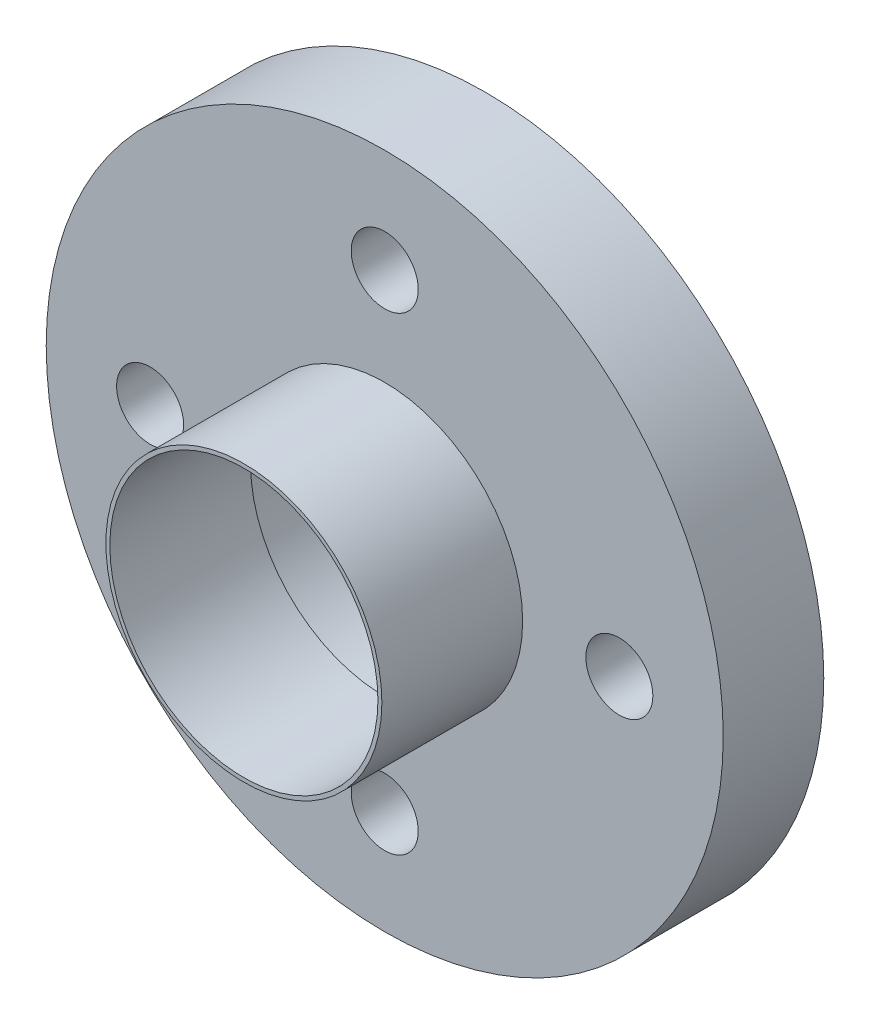
from build123d import *

# Parameters (mm, degrees)
IZIM1_R                     = 1
IZIM1_R_2                   = 4.1
Y_KSEKLIK_EKSTR_ZYON1_DEPTH = 3
IZIM4_R                     = 4.117295272
IZIM4_R_2                   = 4
Y_KSEKLIK_EKSTR_ZYON4_DEPTH = 4.2


with BuildPart() as part:
    # Çizim1 → Yükseklik-Ekstrüzyon1 (new body)
    with BuildSketch(Plane.XY):
        with BuildLine():
            ThreePointArc((-49.825075544, 1.124382022), (-59.925075544, -8.975617978), (-49.825075544, -19.075617978))
            ThreePointArc((-49.825075544, -19.075617978), (-39.725075544, -8.975617978), (-49.825075544, 1.124382022))
        make_face()
        with Locations((-49.825075544, -15.975617978)):
            Circle(IZIM1_R, mode=Mode.SUBTRACT)
        with Locations((-56.825075544, -8.975617978)):
            Circle(IZIM1_R, mode=Mode.SUBTRACT)
        with Locations((-49.825075544, -1.975617978)):
            Circle(IZIM1_R, mode=Mode.SUBTRACT)
        with Locations((-42.825075544, -8.975617978)):
            Circle(IZIM1_R, mode=Mode.SUBTRACT)
        with Locations((-49.825075544, -8.975617978)):
            Circle(IZIM1_R_2, mode=Mode.SUBTRACT)
    extrude(amount=Y_KSEKLIK_EKSTR_ZYON1_DEPTH)


with BuildPart() as body_2:
    # Çizim4 → Yükseklik-Ekstrüzyon4 (new body)
    with BuildSketch(Plane.XY.offset(3)):
        with Locations((-49.827317292, -8.992767351)):
            Circle(IZIM4_R)
        with Locations((-49.827317292, -8.992767351)):
            Circle(IZIM4_R_2, mode=Mode.SUBTRACT)
    extrude(amount=Y_KSEKLIK_EKSTR_ZYON4_DEPTH)


solid = Compound([part.part, body_2.part])
